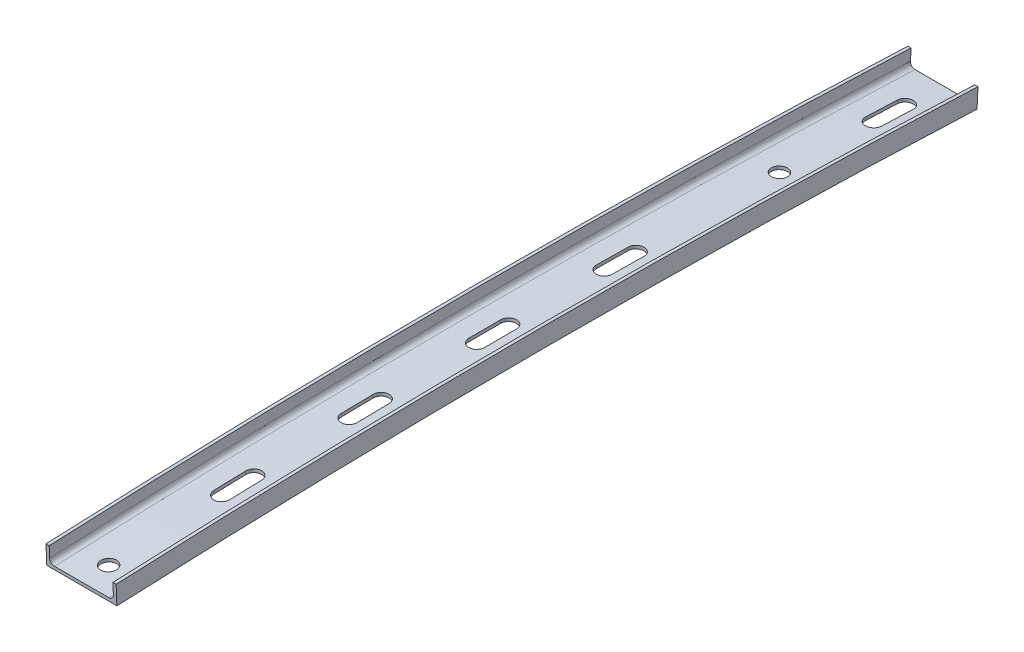
from build123d import *

# Parameters (mm, degrees)
VARIOUS_MOUNTING_POINTS_DEPTH      = 302.472328172
VARIOUS_MOUNTING_POINTS_DEPTH_BACK = 302.472328172
SKETCH4_R                          = 5


with BuildPart() as part:
    # Sweep1: sweep along a path in Sketch3
    with BuildLine(Plane(origin=(0, 0, 0), x_dir=(0, 0, -1), z_dir=(1, 0, 0))) as sweep1_path:
        ThreePointArc((-240, -6), (30, 0.074962051), (300, -6))
    # Sketch1 → Sweep1 (sweep)
    with BuildSketch(Plane.XY):
        with BuildLine():
            Line((-17, 0), (17, 0))
            ThreePointArc((17, 0), (19.121320344, 0.878679656), (20, 3))
            Line((20, 3), (20, 10))
            Line((20, 10), (22, 10))
            Line((22, 10), (22, -2))
            Line((22, -2), (-22, -2))
            Line((-22, -2), (-22, 10))
            Line((-22, 10), (-20, 10))
            Line((-20, 10), (-20, 3))
            ThreePointArc((-20, 3), (-19.121320344, 0.878679656), (-17, 0))
        make_face()
    sweep(path=sweep1_path.line)

    # Sketch4 → Various mounting points (cut, two sides: drawn at the far end of the back side and taken through both)
    with BuildSketch(Plane(origin=(0, 0, 0), x_dir=(1, 0, 0), z_dir=(0, 1, 0)).offset(-VARIOUS_MOUNTING_POINTS_DEPTH_BACK)):
        with Locations(Location((0, 197.900062461, 0), (0, 0, 270))):
            Circle(SKETCH4_R)
        with Locations(Location((0, -223.099937539, 0), (0, 0, 270))):
            Circle(SKETCH4_R)
        with BuildLine():
            Line((-5, 256.900062461), (-5, 276.900062461))
            ThreePointArc((-5, 276.900062461), (0, 281.900062461), (5, 276.900062461))
            Line((5, 276.900062461), (5, 256.900062461))
            ThreePointArc((5, 256.900062461), (0, 251.900062461), (-5, 256.900062461))
        make_face()
        with BuildLine():
            Line((-5, 87.900062461), (-5, 107.900062461))
            ThreePointArc((-5, 107.900062461), (0, 112.900062461), (5, 107.900062461))
            Line((5, 107.900062461), (5, 87.900062461))
            ThreePointArc((5, 87.900062461), (0, 82.900062461), (-5, 87.900062461))
        make_face()
        with BuildLine():
            Line((-5, 7.900062461), (-5, 27.900062461))
            ThreePointArc((-5, 27.900062461), (0, 32.900062461), (5, 27.900062461))
            Line((5, 27.900062461), (5, 7.900062461))
            ThreePointArc((5, 7.900062461), (0, 2.900062461), (-5, 7.900062461))
        make_face()
        with BuildLine():
            Line((-5, -72.099937539), (-5, -52.099937539))
            ThreePointArc((-5, -52.099937539), (0, -47.099937539), (5, -52.099937539))
            Line((5, -52.099937539), (5, -72.099937539))
            ThreePointArc((5, -72.099937539), (0, -77.099937539), (-5, -72.099937539))
        make_face()
        with BuildLine():
            Line((-5, -152.099937539), (-5, -132.099937539))
            ThreePointArc((-5, -132.099937539), (0, -127.099937539), (5, -132.099937539))
            Line((5, -132.099937539), (5, -152.099937539))
            ThreePointArc((5, -152.099937539), (0, -157.099937539), (-5, -152.099937539))
        make_face()
    extrude(amount=VARIOUS_MOUNTING_POINTS_DEPTH + VARIOUS_MOUNTING_POINTS_DEPTH_BACK, mode=Mode.SUBTRACT)


solid = part.part
